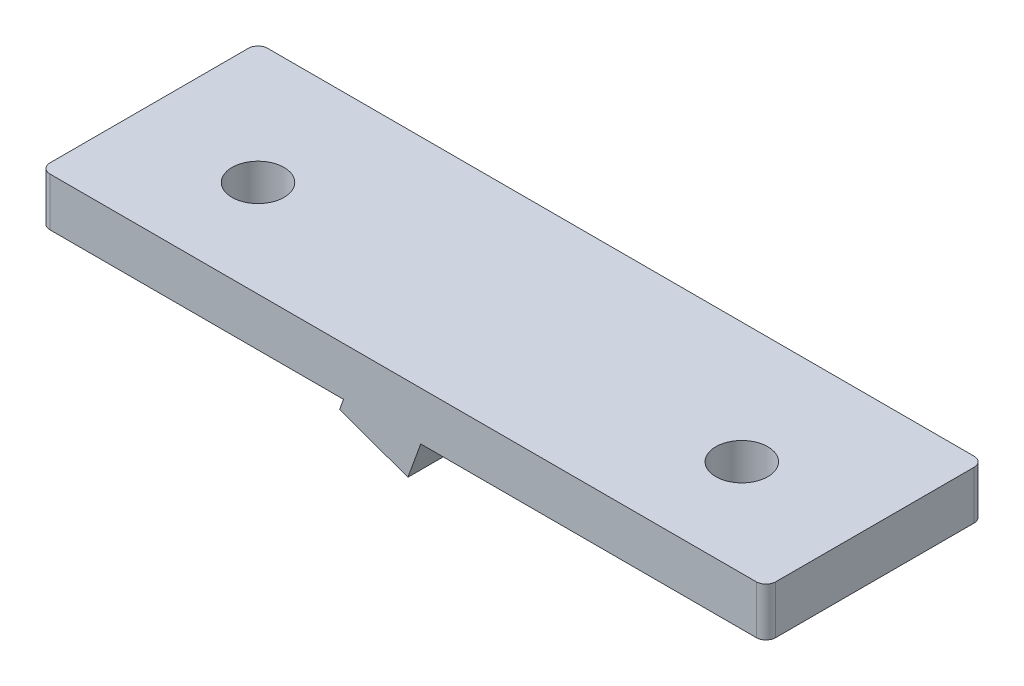
from build123d import *

# Parameters (mm, degrees)
SKETCH_1_W          = 60
SKETCH_1_H          = 18
SKETCH_1_R          = 2.15
EXTRUDE_1_DEPTH     = 4
EXTRUDE_3_DEPTH     = 2.2
CUT_EXTRUDE_1_DEPTH = 2.5
EXTRUDE_2_DEPTH     = 3.981010851
FILLET_1_R          = 0.8


with BuildPart() as part:
    # 草图1 → 凸台-拉伸1 (new body)
    with BuildSketch(Plane(origin=(0, 0, 0), x_dir=(1, 0, 0), z_dir=(0, 1, 0))):
        with Locations((0, 9)):
            Rectangle(SKETCH_1_W, SKETCH_1_H)
        with Locations(Location((-20, 8, 0), (0, 0, 270))):
            Circle(SKETCH_1_R, mode=Mode.SUBTRACT)
        with Locations(Location((20, 8, 0), (0, 0, 270))):
            Circle(SKETCH_1_R, mode=Mode.SUBTRACT)
    extrude(amount=EXTRUDE_1_DEPTH)

    # 草图5 → 凸台-拉伸3 (add)
    with BuildSketch(Plane(origin=(0, 0, -18), x_dir=(-1, 0, 0), z_dir=(0, 0, -1))):
        Polygon((-19.332346445, 0), (10.038960076, 0), (10.380980219, -0.939692621), (-15.554536115, -10.379448577), align=None)
    extrude(amount=-EXTRUDE_3_DEPTH)

    # 草图6 → 切除-拉伸1 (cut)
    with BuildSketch(Plane(origin=(0, 0, -18), x_dir=(-1, 0, 0), z_dir=(0, 0, -1))):
        Polygon((-16.365155241, -8.73705171), (-9.866772518, -26.591211505), (16.444620864, -17.014647492), (9.946238141, 0.839512303), align=None)
    extrude(amount=-CUT_EXTRUDE_1_DEPTH, mode=Mode.SUBTRACT)

    # 草图4 → 凸台-拉伸2 (add)
    with BuildSketch(Plane(origin=(0.467911114, 1.285575219, 0), x_dir=(0, 0, -1), z_dir=(0.34202014332566943, 0.9396926207859081, 0))):
        with BuildLine():
            Line((0, 4.633536704), (4, 4.633536704))
            ThreePointArc((4, 4.633536704), (8, 6.633536704), (12, 4.633536704))
            Line((12, 4.633536704), (18, 4.633536704))
            Line((18, 4.633536704), (18, -1.366463296))
            Line((18, -1.366463296), (12, -1.366463296))
            ThreePointArc((12, -1.366463296), (8, -3.366463296), (4, -1.366463296))
            Line((4, -1.366463296), (0, -1.366463296))
            Line((0, -1.366463296), (0, 4.633536704))
        make_face()
    extrude(amount=-EXTRUDE_2_DEPTH)

    # 圆角1
    fillet_1_edges = [part.edges().sort_by_distance(p)[0] for p in [
        (-30, 2, -18),
        (30, 2, -18),
        (30, 2, 0),
        (-30, 2, 0),
    ]]
    fillet(fillet_1_edges, radius=FILLET_1_R)


solid = part.part
